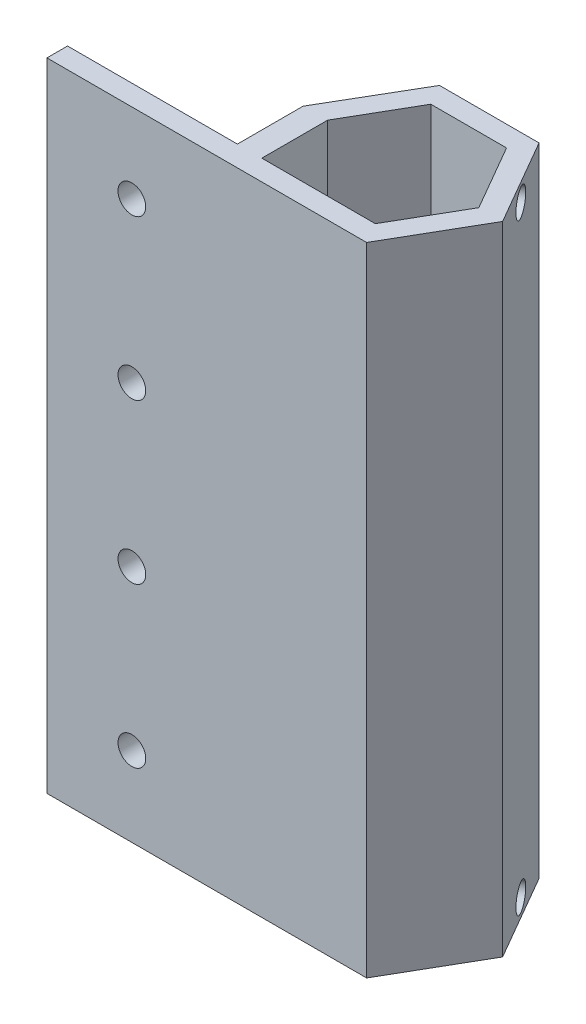
from build123d import *

# Parameters (mm, degrees)
BOSS_EXTRUDE3_DEPTH = 150
SKETCH5_R           = 3.2639
CUT_EXTRUDE1_DEPTH  = 10
SKETCH6_R           = 3.15
CUT_EXTRUDE3_DEPTH  = 10
SKETCH7_W           = 23.443423468
SKETCH7_H           = 1.599424748
SKETCH7_H_2         = 1.6
BOSS_EXTRUDE4_DEPTH = 10


with BuildPart() as part:
    # Sketch4 → Boss-Extrude3 (new body)
    with BuildSketch(Plane(origin=(0, 0, 0), x_dir=(1, 0, 0), z_dir=(0, 1, 0))):
        Polygon((-23.557392252, 0.002600275), (-23.557392252, -15.452600275), (-63.557392252, -15.452600275), (-63.557392252, -20.302600275), (11.721711734, -20.302600275), (23.443423468, 0), (11.721711734, 20.302600275), (-11.721711734, 20.302600275), align=None)
        Polygon((-17.811255804, 0.05), (-17.811255804, -15.45), (8.920061659, -15.45), (17.840123318, 0), (8.920061659, 15.45), (-8.920061659, 15.45), align=None, mode=Mode.SUBTRACT)
    extrude(amount=-BOSS_EXTRUDE3_DEPTH)

    # Sketch5 → Cut-Extrude1 (cut)
    with BuildSketch(Plane(origin=(0, 0, 15.452600275), x_dir=(-1, 0, 0), z_dir=(0, 0, -1))):
        with Locations((43.557392252, -131.25)):
            Circle(SKETCH5_R)
        with Locations((43.557392252, -93.75)):
            Circle(SKETCH5_R)
        with Locations((43.557392252, -56.25)):
            Circle(SKETCH5_R)
        with Locations((43.557392252, -18.75)):
            Circle(SKETCH5_R)
    extrude(amount=-CUT_EXTRUDE1_DEPTH, mode=Mode.SUBTRACT)

    # Sketch6 → Cut-Extrude3 (cut)
    with BuildSketch(Plane(origin=(17.582567601, 0, -10.151300137), x_dir=(-0.4999999999999999, 0, -0.8660254037844387), z_dir=(0.8660254037844387, 0, -0.4999999999999999))):
        with Locations((0, -4.15)):
            Circle(SKETCH6_R)
        with Locations((0, -145.85)):
            Circle(SKETCH6_R)
    extrude(amount=-CUT_EXTRUDE3_DEPTH, mode=Mode.SUBTRACT)

    # Sketch7 → Boss-Extrude4 (add)
    with BuildSketch(Plane(origin=(17.582567601, 0, -10.151300137), x_dir=(-0.4999999999999999, 0, -0.8660254037844387), z_dir=(0.8660254037844387, 0, -0.4999999999999999))):
        with Locations((0, -26.499712374)):
            Rectangle(SKETCH7_W, SKETCH7_H)
        with Locations((0, -123.5)):
            Rectangle(SKETCH7_W, SKETCH7_H_2)
    extrude(amount=-BOSS_EXTRUDE4_DEPTH)


solid = part.part
